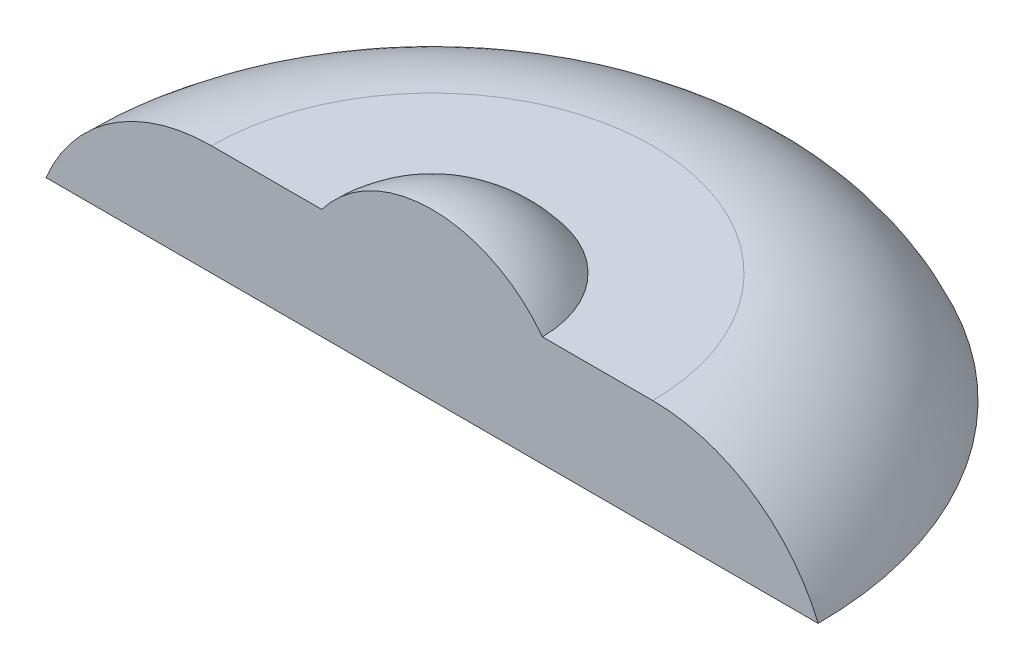
from build123d import *

# Parameters (mm, degrees)
REVOLVE2_ANGLE = 180


with BuildPart() as part:
    # Sketch2 → Revolve2 (revolve)
    with BuildSketch(Plane.XY):
        with BuildLine():
            Line((0, 0), (0, 38.1))
            ThreePointArc((0, 38.1), (14.199031657, 34.748063314), (25.4, 25.4))
            Line((25.4, 25.4), (50.8, 25.4))
            ThreePointArc((50.8, 25.4), (73.695250599, 18.467875899), (88.9, 0))
            Line((88.9, 0), (0, 0))
        make_face()
    revolve(axis=Axis((0, 0, 0), (0, 1, 0)), revolution_arc=REVOLVE2_ANGLE)


solid = part.part
